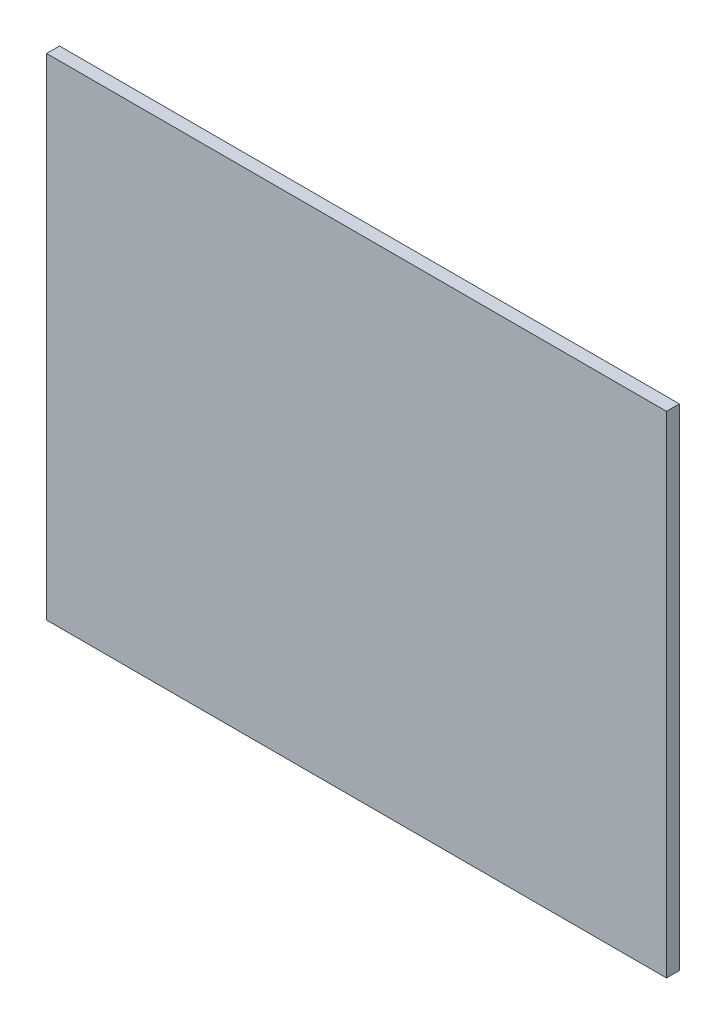
from build123d import *

# Parameters (mm, degrees)
ESQUISSE1_W        = 240
ESQUISSE1_H        = 190
BOSS_EXTRU_1_DEPTH = 5


with BuildPart() as part:
    # Esquisse1 → Boss.-Extru.1 (new body)
    with BuildSketch(Plane.XY):
        with Locations((120, -95)):
            Rectangle(ESQUISSE1_W, ESQUISSE1_H)
    extrude(amount=BOSS_EXTRU_1_DEPTH)


solid = part.part
